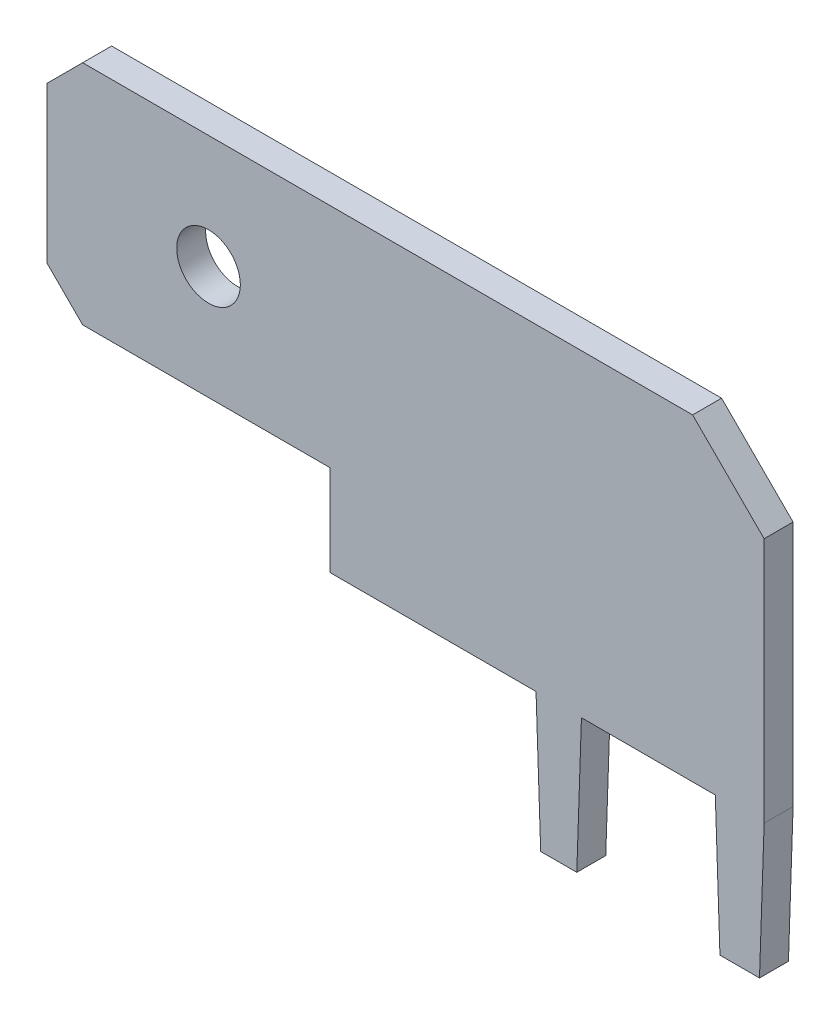
from build123d import *

# Parameters (mm, degrees)
EXTRUSION1_DEPTH        = 0.81
ESQUISSE2_R             = 0.89
ENL_V_MAT_EXTRU_1_DEPTH = 0.81


with BuildPart() as part:
    # Esquisse1 → Extrusion1 (new body)
    with BuildSketch(Plane.XY):
        Polygon((-13.10407394, 11.361851996), (3.95592606, 11.361851996), (5.95592606, 9.361851996), (5.95592606, 2.471851996), (5.826054609, -1.342616085), (4.720113353, -1.342616085), (4.590241902, 2.471851996), (0.846236894, 2.471851996), (0.716236894, -1.338148004), (-0.293763106, -1.338148004), (-0.423763106, 2.471851996), (-6.18407394, 2.471851996), (-6.18407394, 5.011851996), (-13.10407394, 5.011851996), (-14.10407394, 6.011851996), (-14.10407394, 10.361851996), align=None)
    extrude(amount=EXTRUSION1_DEPTH)

    # Esquisse2 → Enlèv. mat.-Extru.1 (cut)
    with BuildSketch(Plane.XY.offset(0.81)):
        with Locations((-9.58407394, 8.186851996)):
            Circle(ESQUISSE2_R)
    extrude(amount=-ENL_V_MAT_EXTRU_1_DEPTH, mode=Mode.SUBTRACT)


solid = part.part
